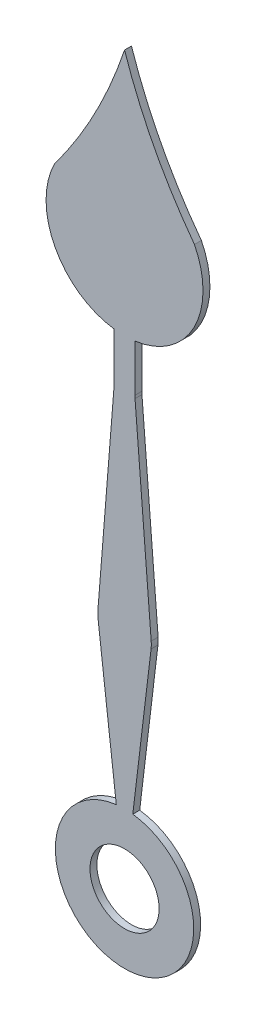
from build123d import *

# Parameters (mm, degrees)
SKETCH1_R           = 1
BOSS_EXTRUDE1_DEPTH = 0.2


with BuildPart() as part:
    # Sketch1 → Boss-Extrude1 (new body)
    with BuildSketch(Plane.XY):
        with BuildLine():
            Line((-0.238423982, 1.985737648), (-0.766818617, 6.386524482))
            ThreePointArc((-0.766818617, 6.386524482), (-0.773753956, 6.48594667), (-0.77075837, 6.585565427))
            Line((-0.77075837, 6.585565427), (-0.303191424, 12.423982653))
            ThreePointArc((-0.303191424, 12.423982653), (-0.300798174, 12.463865246), (-0.3, 12.503811607))
            Line((-0.3, 12.503811607), (-0.3, 13.862922443))
            ThreePointArc((-0.3, 13.862922443), (-2.008962857, 15.057847822), (-2.020381908, 17.143098483))
            ThreePointArc((-2.020381908, 17.143098483), (-0.856036284, 18.990797554), (0, 21))
            ThreePointArc((0, 21), (0.856036284, 18.990797554), (2.020381908, 17.143098483))
            ThreePointArc((2.020381908, 17.143098483), (2.008962857, 15.057847822), (0.3, 13.862922443))
            Line((0.3, 13.862922443), (0.3, 12.503811607))
            ThreePointArc((0.3, 12.503811607), (0.300798174, 12.463865246), (0.303191424, 12.423982653))
            Line((0.303191424, 12.423982653), (0.77075837, 6.585565427))
            ThreePointArc((0.77075837, 6.585565427), (0.773753956, 6.48594667), (0.766818617, 6.386524482))
            Line((0.766818617, 6.386524482), (0.238423982, 1.985737648))
            ThreePointArc((0.238423982, 1.985737648), (0, -2), (-0.238423982, 1.985737648))
        make_face()
        Circle(SKETCH1_R, mode=Mode.SUBTRACT)
    extrude(amount=BOSS_EXTRUDE1_DEPTH)


solid = part.part
